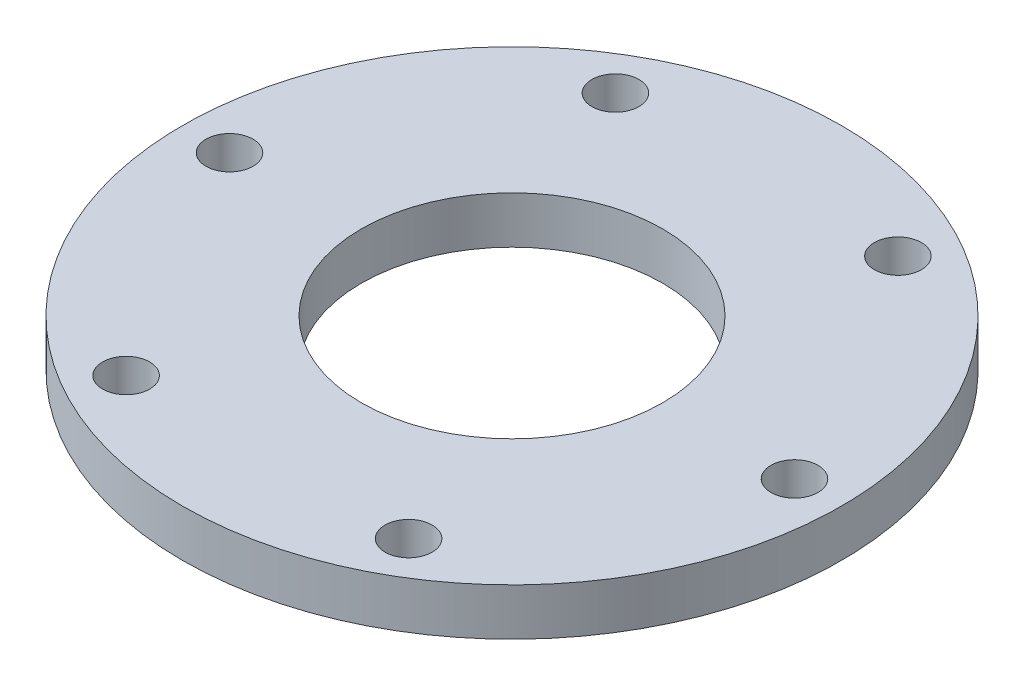
from build123d import *

# Parameters (mm, degrees)
SKETCH2_R           = 44.45
SKETCH2_R_2         = 20.32
SKETCH2_R_3         = 3.175
BOSS_EXTRUDE1_DEPTH = 6.35


with BuildPart() as part:
    # Sketch2 → Boss-Extrude1 (new body)
    with BuildSketch(Plane(origin=(0, 0, 0), x_dir=(1, 0, 0), z_dir=(0, 1, 0))):
        with Locations(Location((0, 0, 0), (0, 0, 270))):
            Circle(SKETCH2_R)
        with Locations(Location((0, 0, 0), (0, 0, 270))):
            Circle(SKETCH2_R_2, mode=Mode.SUBTRACT)
        with Locations(Location((38.1, 0, 0), (0, 0, 270))):
            Circle(SKETCH2_R_3, mode=Mode.SUBTRACT)
        with Locations(Location((19.05, -32.995567884, 0), (0, 0, 270))):
            Circle(SKETCH2_R_3, mode=Mode.SUBTRACT)
        with Locations(Location((-19.05, -32.995567884, 0), (0, 0, 270))):
            Circle(SKETCH2_R_3, mode=Mode.SUBTRACT)
        with Locations(Location((-38.1, 0, 0), (0, 0, 270))):
            Circle(SKETCH2_R_3, mode=Mode.SUBTRACT)
        with Locations(Location((-19.05, 32.995567884, 0), (0, 0, 270))):
            Circle(SKETCH2_R_3, mode=Mode.SUBTRACT)
        with Locations(Location((19.05, 32.995567884, 0), (0, 0, 270))):
            Circle(SKETCH2_R_3, mode=Mode.SUBTRACT)
    extrude(amount=BOSS_EXTRUDE1_DEPTH)


solid = part.part
